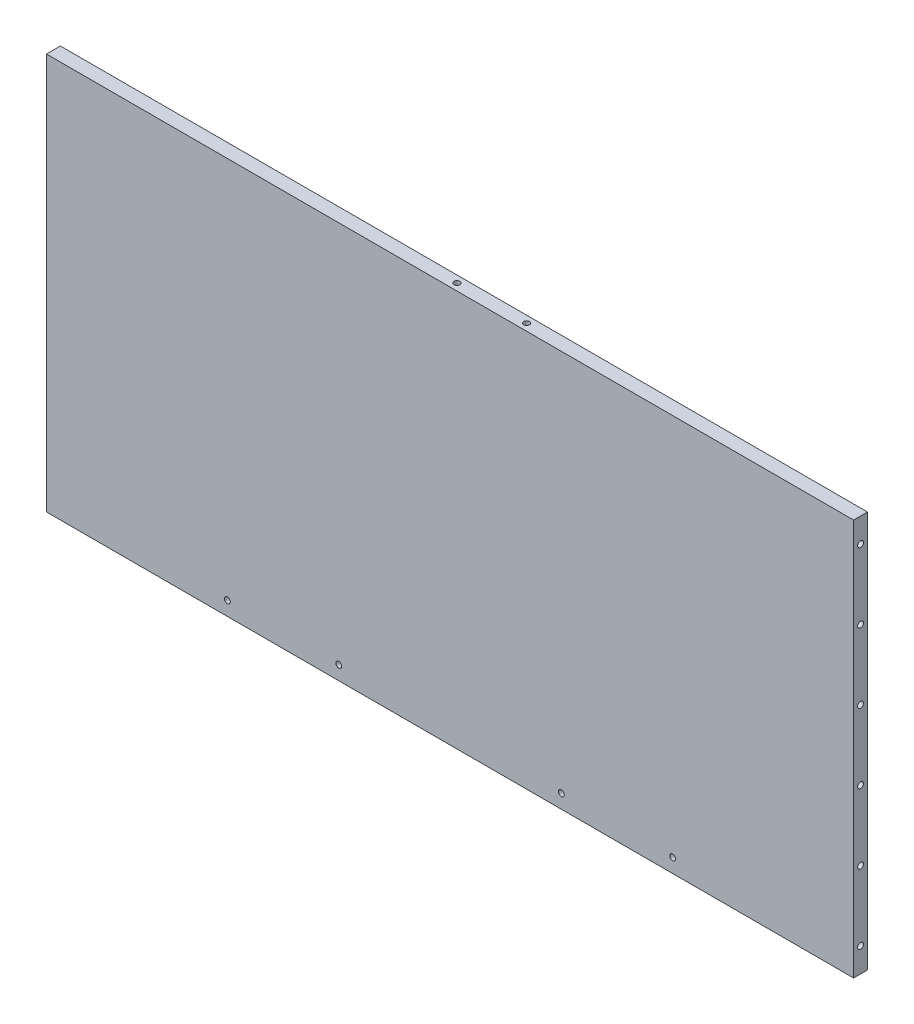
from build123d import *

# Parameters (mm, degrees)
SKETCH_1_W             = 580
SKETCH_1_H             = 285
EXTRUDE_1_DEPTH        = 10
HOLE_WIZARD_M5_1_D     = 4.2
HOLE_WIZARD_M5_2_D     = 4.2
HOLE_WIZARD_M5_3_D     = 4.2
SKETCH_11_W            = 330
SKETCH_11_H            = 80
CUT_EXTRUDE_1_DEPTH    = 2
HOLE_WIZARD_M5_4_D     = 4.2
HOLE_WIZARD_M5_4_DEPTH = 2
HOLE_WIZARD_M5_4_TIP   = 1.2618073


with BuildPart() as part:
    # 草图1 → 凸台-拉伸1 (new body)
    with BuildSketch(Plane.XY):
        Rectangle(SKETCH_1_W, SKETCH_1_H)
    extrude(amount=EXTRUDE_1_DEPTH)

    # M5 螺纹孔1 (through all)
    with Locations(Plane(origin=(290, 0, 0), x_dir=(0, 0, -1), z_dir=(1, 0, 0))):
        with Locations((-5, 125), (-5, 75), (-5, 25), (-5, -25), (-5, -75), (-5, -125)):
            Hole(HOLE_WIZARD_M5_1_D / 2)

    # M5 螺纹孔2 (through all)
    with Locations(Plane(origin=(0, 142.5, 0), x_dir=(1, 0, 0), z_dir=(0, 1, 0))):
        with Locations((0, -5), (50, -5)):
            Hole(HOLE_WIZARD_M5_2_D / 2)

    # M5 螺纹孔3 (through all)
    with Locations(Plane.XY.offset(10)):
        with Locations((-160, -132.5), (-80, -132.5), (80, -132.5), (160, -132.5)):
            Hole(HOLE_WIZARD_M5_3_D / 2)

    # 草图11 → 切除-拉伸1 (cut)
    with BuildSketch(Plane(origin=(0, 0, 0), x_dir=(-1, 0, 0), z_dir=(0, 0, -1))):
        with Locations((0, 87.5)):
            Rectangle(SKETCH_11_W, SKETCH_11_H)
    extrude(amount=-CUT_EXTRUDE_1_DEPTH, mode=Mode.SUBTRACT)

    # M5 螺纹孔4
    with Locations(Plane(origin=(0, 0, 2), x_dir=(-1, 0, 0), z_dir=(0, 0, -1))):
        with Locations((-155, 119.5), (-155, 55.5), (155, 55.5), (155, 119.5)):
            Hole(HOLE_WIZARD_M5_4_D / 2, depth=HOLE_WIZARD_M5_4_DEPTH)
            with Locations((0, 0, -(HOLE_WIZARD_M5_4_DEPTH + HOLE_WIZARD_M5_4_TIP / 2))):  # 118° drill point
                Cone(0, HOLE_WIZARD_M5_4_D / 2, HOLE_WIZARD_M5_4_TIP, mode=Mode.SUBTRACT)


solid = part.part
